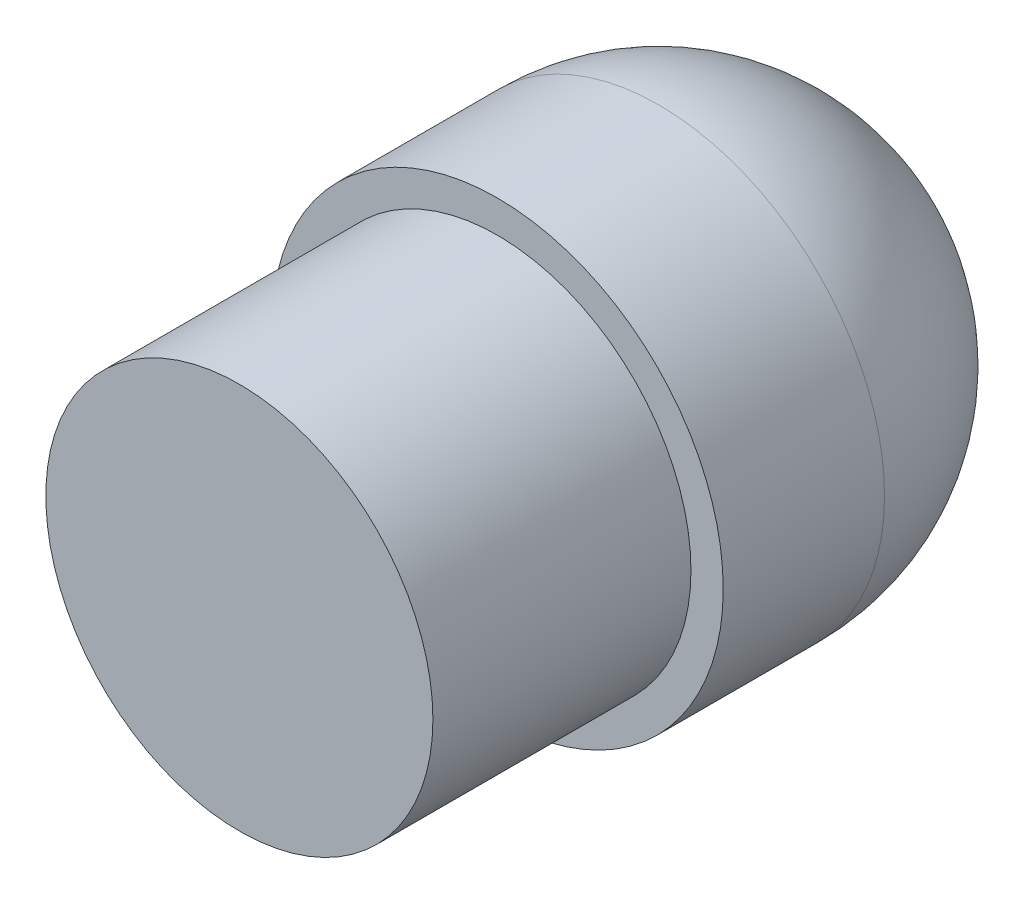
from build123d import *

# Parameters (mm, degrees)
SKETCH1_R           = 17.5
BOSS_EXTRUDE1_DEPTH = 25
SKETCH2_R           = 17.5
SKETCH2_R_2         = 15
CUT_EXTRUDE1_DEPTH  = 20
FILLET1_R           = 17.5


with BuildPart() as part:
    # Sketch1 → Boss-Extrude1 (new, symmetric)
    with BuildSketch(Plane.XY):
        Circle(SKETCH1_R)
    extrude(amount=BOSS_EXTRUDE1_DEPTH, both=True)

    # Sketch2 → Cut-Extrude1 (cut)
    with BuildSketch(Plane.XY.offset(25)):
        Circle(SKETCH2_R)
        Circle(SKETCH2_R_2, mode=Mode.SUBTRACT)
    extrude(amount=-CUT_EXTRUDE1_DEPTH, mode=Mode.SUBTRACT)

    # Fillet1
    fillet1_edges = [part.edges().sort_by_distance(p)[0] for p in [
        (-17.5, 0, -25),
    ]]
    fillet(fillet1_edges, radius=FILLET1_R)


solid = part.part
